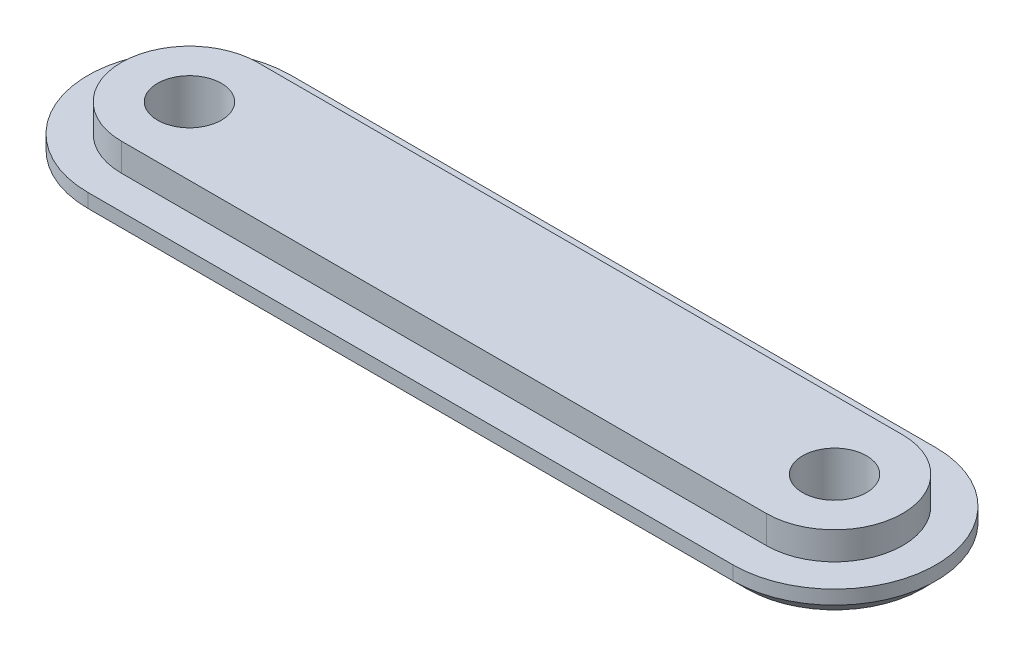
from build123d import *

# Parameters (mm, degrees)
BOSS_EXTRUDE1_DEPTH = 1
BOSS_EXTRUDE2_DEPTH = 1
SKETCH4_R           = 1.15
CUT_EXTRUDE1_DEPTH  = 16.807751263
CHAMFER1_SIZE       = 0.5


with BuildPart() as part:
    # Sketch2 → Boss-Extrude1 (new body)
    with BuildSketch(Plane(origin=(0, 0, 0), x_dir=(1, 0, 0), z_dir=(0, 1, 0))):
        with BuildLine():
            Line((11.6, 3.65), (-11.6, 3.65))
            ThreePointArc((-11.6, 3.65), (-15.25, 0), (-11.6, -3.65))
            Line((-11.6, -3.65), (11.6, -3.65))
            ThreePointArc((11.6, -3.65), (15.25, 0), (11.6, 3.65))
        make_face()
    extrude(amount=-BOSS_EXTRUDE1_DEPTH)

    # Sketch3 → Boss-Extrude2 (add)
    with BuildSketch(Plane(origin=(0, 0, 0), x_dir=(1, 0, 0), z_dir=(0, 1, 0))):
        with BuildLine():
            Line((-11.6, -2.45), (11.6, -2.45))
            ThreePointArc((11.6, -2.45), (14.05, 0), (11.6, 2.45))
            Line((11.6, 2.45), (-11.6, 2.45))
            ThreePointArc((-11.6, 2.45), (-14.05, 0), (-11.6, -2.45))
        make_face()
    extrude(amount=BOSS_EXTRUDE2_DEPTH)

    # Sketch4 → Cut-Extrude1 (cut, through all)
    with BuildSketch(Plane(origin=(0, 1, 0), x_dir=(1, 0, 0), z_dir=(0, 1, 0))):
        with Locations(Location((-11.6, 0, 0), (0, 0, 270))):
            Circle(SKETCH4_R)
        with Locations(Location((11.6, 0, 0), (0, 0, 270))):
            Circle(SKETCH4_R)
    extrude(amount=-CUT_EXTRUDE1_DEPTH, mode=Mode.SUBTRACT)

    # Chamfer1
    chamfer1_edges = [part.edges().sort_by_distance(p)[0] for p in [
        (15.25, -1, 0),
        (0, -1, -3.65),
        (-15.25, -1, 0),
        (0, -1, 3.65),
    ]]
    chamfer(chamfer1_edges, length=CHAMFER1_SIZE)


solid = part.part
